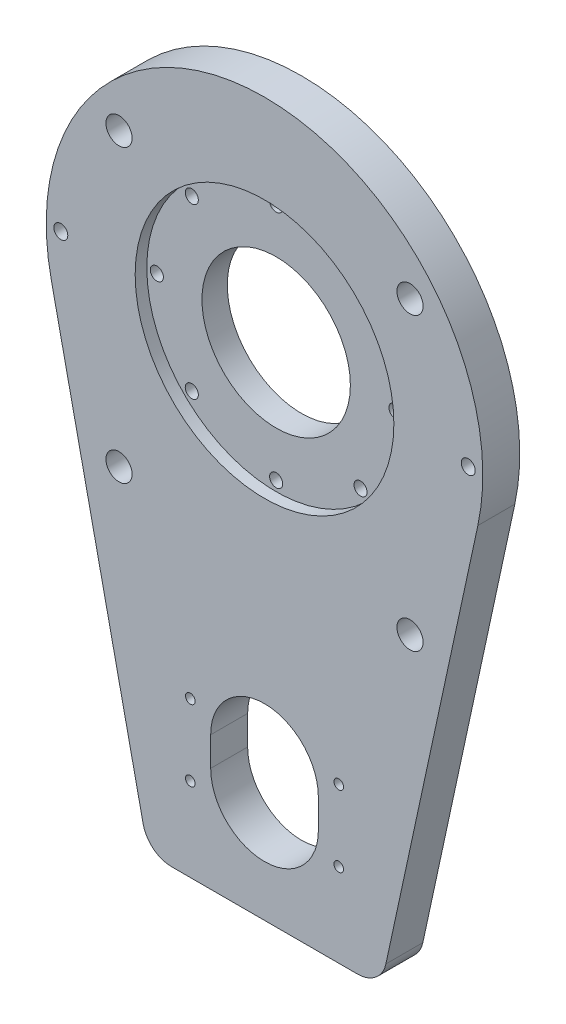
from build123d import *

# Parameters (mm, degrees)
BOSS_EXTRUDE1_DEPTH            = 12.7
CUT_EXTRUDE1_DEPTH             = 187.242556898
M8_CLEARANCE_HOLE1_D           = 9
M8_CLEARANCE_HOLE1_DEPTH       = 25.4
M8_CLEARANCE_HOLE1_TIP         = 2.703872786
M4X0_7_TAPPED_HOLE1_D          = 3.3
M4_CLEARANCE_HOLE1_D           = 4.8
HOLE2_D                        = 51
HOLE2_CBORE_D                  = 88.9
HOLE2_CBORE_DEPTH              = 4
CBORE_FOR_M4_SHCS1_D           = 4.5
CBORE_FOR_M4_SHCS1_CBORE_D     = 8
CBORE_FOR_M4_SHCS1_CBORE_DEPTH = 4
FILLET1_R                      = 10


with BuildPart() as part:
    # Sketch1 → Boss-Extrude1 (new body)
    with BuildSketch(Plane.XY.offset(12.7)):
        with BuildLine():
            Line((40, -170), (73.308387301, -15.839202988))
            ThreePointArc((73.308387301, -15.839202988), (0, 75), (-73.308387301, -15.839202988))
            Line((-73.308387301, -15.839202988), (-40, -170))
            Line((-40, -170), (40, -170))
        make_face()
    extrude(amount=-BOSS_EXTRUDE1_DEPTH)

    # Sketch2 → Cut-Extrude1 (cut, through all)
    with BuildSketch(Plane(origin=(0, 0, 0), x_dir=(-1, 0, 0), z_dir=(0, 0, -1))):
        with BuildLine():
            Line((-18.5, -124), (-18.5, -134))
            ThreePointArc((-18.5, -134), (0, -152.5), (18.5, -134))
            Line((18.5, -134), (18.5, -124))
            ThreePointArc((18.5, -124), (0, -105.5), (-18.5, -124))
        make_face()
    extrude(amount=-CUT_EXTRUDE1_DEPTH, mode=Mode.SUBTRACT)

    # M8 Clearance Hole1
    with Locations(Plane(origin=(0, 0, 0), x_dir=(-1, 0, 0), z_dir=(0, 0, -1))):
        with Locations((-50, -60), (50, -60), (-50, 40), (50, 40)):
            Hole(M8_CLEARANCE_HOLE1_D / 2, depth=M8_CLEARANCE_HOLE1_DEPTH)
            with Locations((0, 0, -(M8_CLEARANCE_HOLE1_DEPTH + M8_CLEARANCE_HOLE1_TIP / 2))):  # 118° drill point
                Cone(0, M8_CLEARANCE_HOLE1_D / 2, M8_CLEARANCE_HOLE1_TIP, mode=Mode.SUBTRACT)

    # M4x0.7 Tapped Hole1 (through all)
    with Locations(Plane.XY.offset(12.7)):
        with Locations((-25.5, -116.75), (-25.5, -141.25), (25.5, -116.75), (25.5, -141.25)):
            Hole(M4X0_7_TAPPED_HOLE1_D / 2)

    # M4 Clearance Hole1 (through all)
    with Locations(Plane.XY.offset(12.7)):
        with Locations((70, 0), (-70, 0)):
            Hole(M4_CLEARANCE_HOLE1_D / 2)

    # Hole2 (through all)
    with Locations(Plane.XY.offset(12.7)):
        with Locations((0, 0)):
            CounterBoreHole(HOLE2_D / 2, HOLE2_CBORE_D / 2, HOLE2_CBORE_DEPTH)

    # CBORE for M4 SHCS1 (through all)
    with Locations(Plane(origin=(0, 0, 0), x_dir=(-1, 0, 0), z_dir=(0, 0, -1))):
        with Locations((28.991378029, 28.991378029), (41, 0), (28.991378029, -28.991378029), (0, -41), (-28.991378029, -28.991378029), (-41, 0), (-28.991378029, 28.991378029), (0, 41)):
            CounterBoreHole(CBORE_FOR_M4_SHCS1_D / 2, CBORE_FOR_M4_SHCS1_CBORE_D / 2, CBORE_FOR_M4_SHCS1_CBORE_DEPTH)

    # Fillet1
    fillet1_edges = [part.edges().sort_by_distance(p)[0] for p in [
        (-40, -170, 6.35),
        (40, -170, 6.35),
    ]]
    fillet(fillet1_edges, radius=FILLET1_R)


solid = part.part
